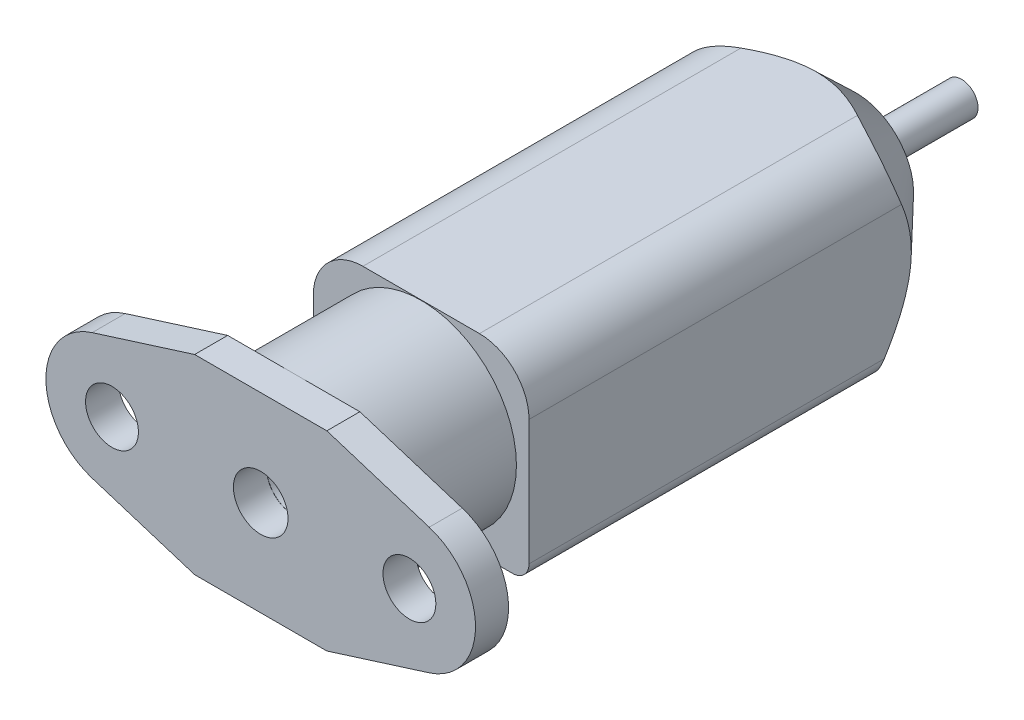
from build123d import *

# Parameters (mm, degrees)
CROQUIS1_R               = 1.6
CROQUIS1_R_2             = 1.652819296
SALIENTE_EXTRUIR7_DEPTH  = 2
CROQUIS2_R               = 5.764999893
CROQUIS2_R_2             = 1.651186543
SALIENTE_EXTRUIR8_DEPTH  = 7.7
SALIENTE_EXTRUIR9_DEPTH  = 26.3
CROQUIS6_R               = 0.999415005
SALIENTE_EXTRUIR10_DEPTH = 6.4


with BuildPart() as part:
    # Croquis1 → Saliente-Extruir7 (new body)
    with BuildSketch(Plane.XY):
        with BuildLine():
            Line((3.989800866, 5.77), (10.185352527, 3.816574712))
            ThreePointArc((10.185352527, 3.816574712), (12.987940257, 0.01136727), (10.207025117, -3.809707533))
            Line((10.207025117, -3.809707533), (3.989800866, -5.77))
            Line((3.989800866, -5.77), (-4.010199134, -5.77))
            Line((-4.010199134, -5.77), (-10.210821317, -3.816140978))
            ThreePointArc((-10.210821317, -3.816140978), (-13.012043591, -4.0807e-05), (-10.210899179, 3.816116518))
            Line((-10.210899179, 3.816116518), (-4.010199134, 5.77))
            Line((-4.010199134, 5.77), (3.989800866, 5.77))
        make_face()
        with Locations((8.987956409, 0)):
            Circle(CROQUIS1_R, mode=Mode.SUBTRACT)
        with Locations((-9.012043591, 0)):
            Circle(CROQUIS1_R, mode=Mode.SUBTRACT)
        with Locations((-0.012043591, -0.005120561)):
            Circle(CROQUIS1_R_2, mode=Mode.SUBTRACT)
    extrude(amount=-SALIENTE_EXTRUIR7_DEPTH)

    # Croquis2 → Saliente-Extruir8 (add)
    with BuildSketch(Plane(origin=(0, 0, -2), x_dir=(-1, 0, 0), z_dir=(0, 0, -1))):
        with Locations(Location((0, 0, 0), (0, 0, 180))):
            Circle(CROQUIS2_R)
        with Locations(Location((0, 0, 0), (0, 0, 240.0245302))):
            Circle(CROQUIS2_R_2, mode=Mode.SUBTRACT)
    extrude(amount=SALIENTE_EXTRUIR8_DEPTH)

    # Croquis3 → Saliente-Extruir9 (add)
    with BuildSketch(Plane(origin=(0, 0, -9.7), x_dir=(-1, 0, 0), z_dir=(0, 0, -1))):
        with BuildLine():
            Line((3.526868458, 5.783774708), (-3.526868458, 5.783774708))
            ThreePointArc((-3.526868458, 5.783774708), (-5.648188802, 4.905095052), (-6.526868458, 2.783774708))
            Line((-6.526868458, 2.783774708), (-6.526868458, -4.783774708))
            ThreePointArc((-6.526868458, -4.783774708), (-6.233975239, -5.490881489), (-5.526868458, -5.783774708))
            Line((-5.526868458, -5.783774708), (5.526868458, -5.783774708))
            ThreePointArc((5.526868458, -5.783774708), (6.233975239, -5.490881489), (6.526868458, -4.783774708))
            Line((6.526868458, -4.783774708), (6.526868458, 2.783774708))
            ThreePointArc((6.526868458, 2.783774708), (5.648188802, 4.905095052), (3.526868458, 5.783774708))
        make_face()
    extrude(amount=SALIENTE_EXTRUIR9_DEPTH)

    # Croquis5 → Cortar-Revolución1 (revolve, cut)
    with BuildSketch(Plane(origin=(0, 0, 0), x_dir=(1, 0, 0), z_dir=(0, 1, 0)), mode=Mode.PRIVATE) as cortar_revoluci_n1_sk:
        Polygon((-3.5, 36), (-8.472559386, 30.803521887), (-8.472559386, 36), align=None)
    revolve(cortar_revoluci_n1_sk.sketch.rotate(Axis((0, 0, -39.9199001), (0, 0, 1)), 203.098732746), axis=Axis((0, 0, -39.9199001), (0, 0, 1)), mode=Mode.SUBTRACT)

    # Croquis6 → Saliente-Extruir10 (add)
    with BuildSketch(Plane(origin=(0, 0, -36), x_dir=(-1, 0, 0), z_dir=(0, 0, -1))):
        Circle(CROQUIS6_R)
    extrude(amount=SALIENTE_EXTRUIR10_DEPTH)


solid = part.part
